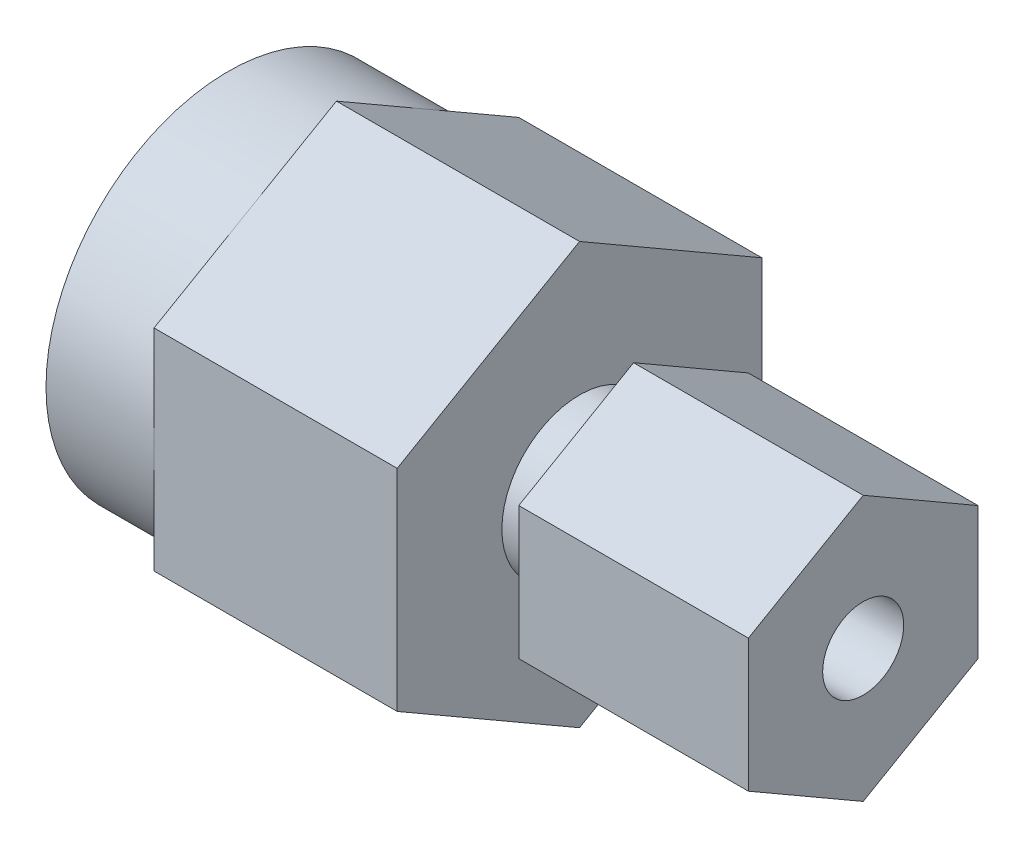
from build123d import *

# Parameters (mm, degrees)
SKICA2_R                 = 11.379305307
ODEBRAT_VYSUNUT_M1_DEPTH = 18
SKICA3_R                 = 12.741299312
P_IDAT_VYSUNUT_M1_DEPTH  = 18


with BuildPart() as part:
    # Skica1 → Rotovat1 (revolve)
    with BuildSketch(Plane.XY, mode=Mode.PRIVATE) as rotovat1_sk:
        Polygon((0, 9.5), (0, 13.5), (26, 13.5), (26, 5.75), (30, 5.75), (30, 10), (47, 10), (47, 3), (30.5, 3), (30.5, 2), (23, 2), (23, 3), (20, 3), (20, 9.5), align=None)
    revolve(rotovat1_sk.sketch.rotate(Axis((0, 0, 0), (1, 0, 0)), 90), axis=Axis((0, 0, 0), (1, 0, 0)))

    # Skica2 → Odebrat vysunutím1 (cut)
    with BuildSketch(Plane(origin=(47, 0, 0), x_dir=(0, 0, -1), z_dir=(1, 0, 0))):
        Circle(SKICA2_R)
        Polygon((0, 9.814954576), (-8.5, 4.907477288), (-8.5, -4.907477288), (0, -9.814954576), (8.5, -4.907477288), (8.5, 4.907477288), align=None, mode=Mode.SUBTRACT)
    extrude(amount=-ODEBRAT_VYSUNUT_M1_DEPTH, mode=Mode.SUBTRACT)

    # Skica3 → Přidat vysunutím1 (add)
    with BuildSketch(Plane(origin=(26, 0, 0), x_dir=(0, 0, -1), z_dir=(1, 0, 0))):
        Polygon((0, 15.588457268), (-13.5, 7.794228634), (-13.5, -7.794228634), (0, -15.588457268), (13.5, -7.794228634), (13.5, 7.794228634), align=None)
        Circle(SKICA3_R, mode=Mode.SUBTRACT)
    extrude(amount=-P_IDAT_VYSUNUT_M1_DEPTH)


solid = part.part
